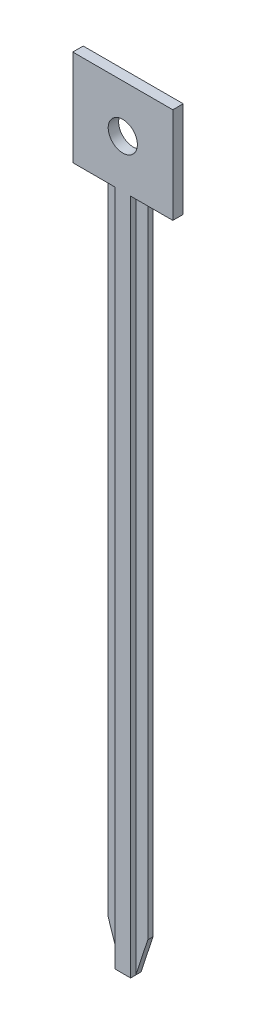
from build123d import *

# Parameters (mm, degrees)
BOSS_EXTRUDE1_DEPTH = 1.27
CUT_EXTRUDE1_DEPTH  = 0.635
SKETCH3_R           = 1.778
CUT_EXTRUDE2_DEPTH  = 96.027914425


with BuildPart() as part:
    # Sketch1 → Boss-Extrude1 (new body)
    with BuildSketch(Plane.XY):
        Polygon((0, 0), (12.192, 0), (12.192, -11.684), (8.509, -11.684), (8.509, -89.789), (7.0485, -94.234), (5.1435, -94.234), (3.683, -89.789), (3.683, -11.684), (0, -11.684), align=None)
    extrude(amount=BOSS_EXTRUDE1_DEPTH)

    # Sketch2 → Cut-Extrude1 (cut)
    with BuildSketch(Plane.XY.offset(1.27)):
        Polygon((5.1435, -94.234), (5.1435, -11.684), (3.683, -11.684), (3.683, -89.789), align=None)
        Polygon((8.509, -11.684), (8.509, -89.789), (7.0485, -94.234), (7.0485, -11.684), align=None)
    extrude(amount=-CUT_EXTRUDE1_DEPTH, mode=Mode.SUBTRACT)

    # Sketch3 → Cut-Extrude2 (cut, through all)
    with BuildSketch(Plane.XY.offset(1.27)):
        with Locations((6.096, -5.842)):
            Circle(SKETCH3_R)
    extrude(amount=-CUT_EXTRUDE2_DEPTH, mode=Mode.SUBTRACT)


solid = part.part
